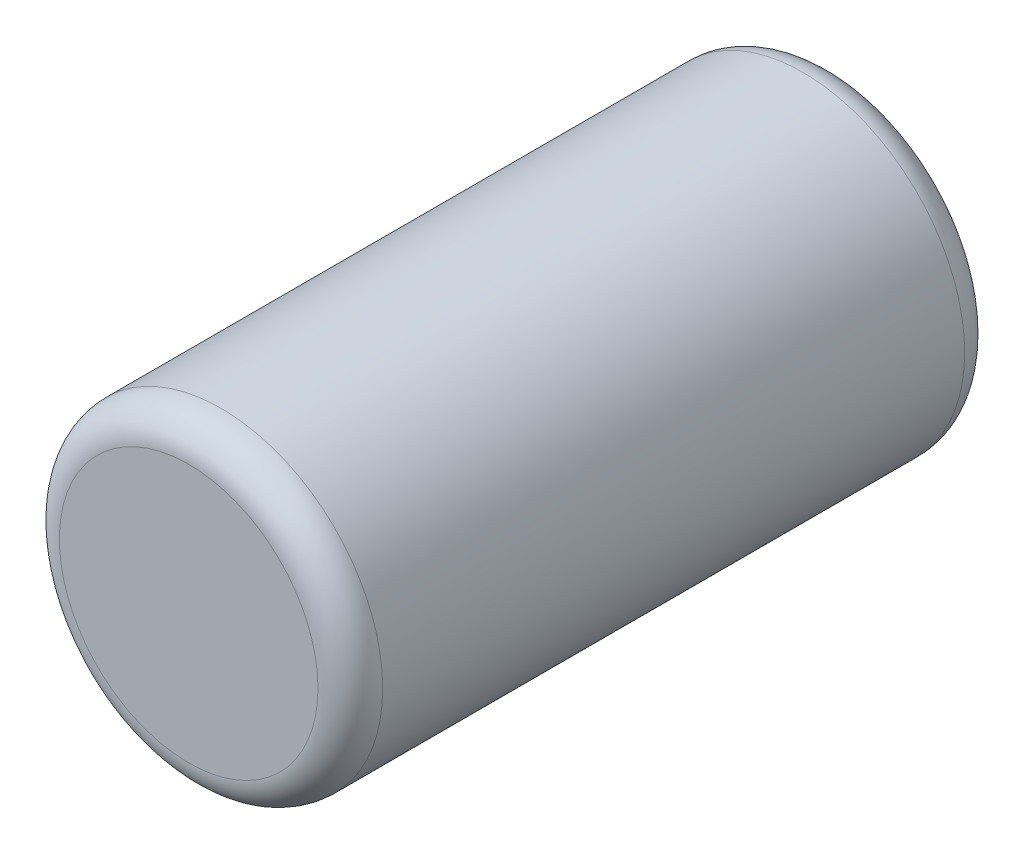
from build123d import *

# Parameters (mm, degrees)
SKETCH_1_R      = 1.5
EXTRUDE_1_DEPTH = 3
FILLET_1_R      = 0.3
FILLET_2_R      = 0.3


with BuildPart() as part:
    # 草图1 → 拉伸1 (new, symmetric)
    with BuildSketch(Plane.XY):
        Circle(SKETCH_1_R)
    extrude(amount=EXTRUDE_1_DEPTH, both=True)

    # 圆角1
    fillet_1_edges = [part.edges().sort_by_distance(p)[0] for p in [
        (-1.5, 0, 3),
    ]]
    fillet(fillet_1_edges, radius=FILLET_1_R)

    # 圆角2
    fillet_2_edges = [part.edges().sort_by_distance(p)[0] for p in [
        (-1.5, 0, -3),
    ]]
    fillet(fillet_2_edges, radius=FILLET_2_R)


solid = part.part
